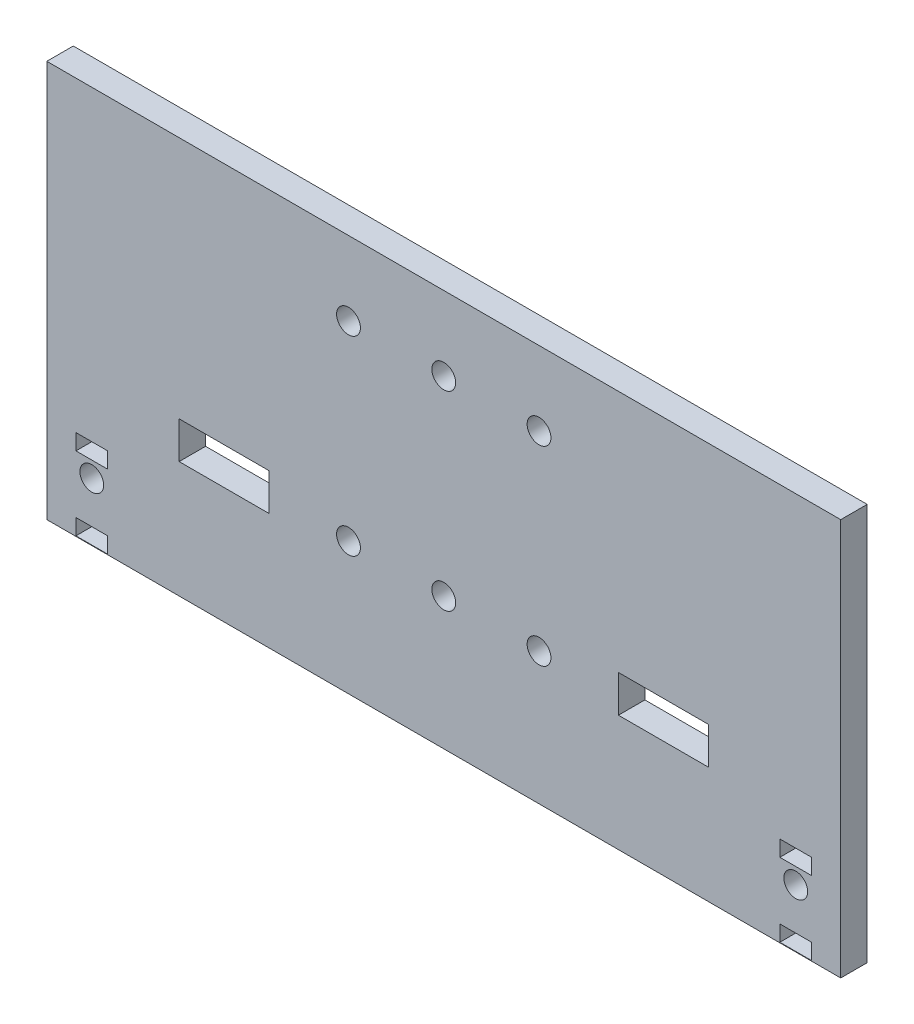
from build123d import *

# Parameters (mm, degrees)
ESQUISSE1_W        = 150
ESQUISSE1_H        = 75
ESQUISSE1_R        = 2.25
ESQUISSE1_W_2      = 6
ESQUISSE1_H_2      = 3
ESQUISSE1_W_3      = 17
ESQUISSE1_H_3      = 7
BOSS_EXTRU_1_DEPTH = 5


with BuildPart() as part:
    # Esquisse1 → Boss.-Extru.1 (new body)
    with BuildSketch(Plane.XY):
        with Locations((75, -37.5)):
            Rectangle(ESQUISSE1_W, ESQUISSE1_H)
        with Locations((8.5, -64)):
            Circle(ESQUISSE1_R, mode=Mode.SUBTRACT)
        with Locations((141.5, -64)):
            Circle(ESQUISSE1_R, mode=Mode.SUBTRACT)
        with Locations((57, -14)):
            Circle(ESQUISSE1_R, mode=Mode.SUBTRACT)
        with Locations((93, -14)):
            Circle(ESQUISSE1_R, mode=Mode.SUBTRACT)
        with Locations((93, -50)):
            Circle(ESQUISSE1_R, mode=Mode.SUBTRACT)
        with Locations((57, -50)):
            Circle(ESQUISSE1_R, mode=Mode.SUBTRACT)
        with Locations((75, -14)):
            Circle(ESQUISSE1_R, mode=Mode.SUBTRACT)
        with Locations((75, -50)):
            Circle(ESQUISSE1_R, mode=Mode.SUBTRACT)
        with Locations((8.5, -59.5)):
            Rectangle(ESQUISSE1_W_2, ESQUISSE1_H_2, mode=Mode.SUBTRACT)
        with Locations((8.5, -73.4)):
            Rectangle(ESQUISSE1_W_2, ESQUISSE1_H_2, mode=Mode.SUBTRACT)
        with Locations((141.5, -59.5)):
            Rectangle(ESQUISSE1_W_2, ESQUISSE1_H_2, mode=Mode.SUBTRACT)
        with Locations((141.5, -73.4)):
            Rectangle(ESQUISSE1_W_2, ESQUISSE1_H_2, mode=Mode.SUBTRACT)
        with Locations((33.5, -49.5)):
            Rectangle(ESQUISSE1_W_3, ESQUISSE1_H_3, mode=Mode.SUBTRACT)
        with Locations((116.5, -49.5)):
            Rectangle(ESQUISSE1_W_3, ESQUISSE1_H_3, mode=Mode.SUBTRACT)
    extrude(amount=BOSS_EXTRU_1_DEPTH)


solid = part.part
